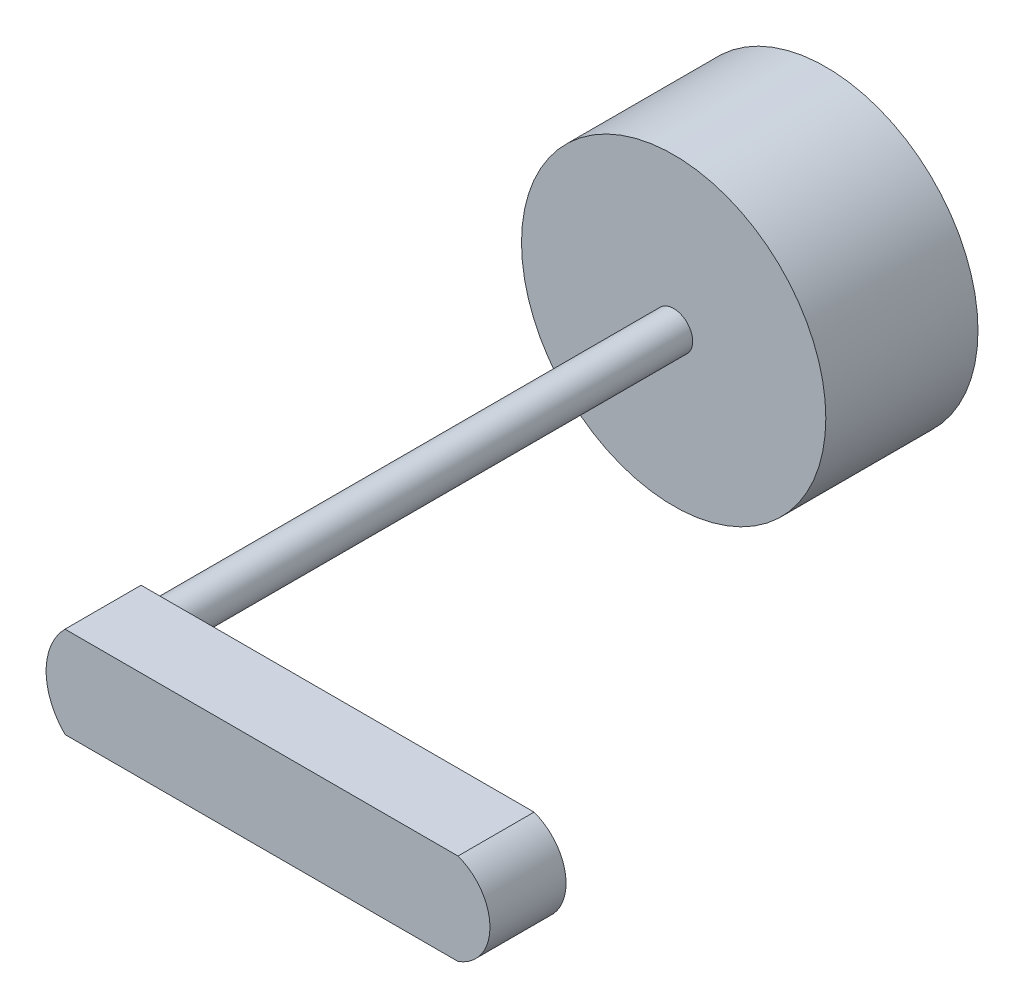
from build123d import *

# Parameters (mm, degrees)
SKETCH_1_R      = 10
EXTRUDE_1_DEPTH = 10
SKETCH_2_R      = 1.25
EXTRUDE_2_DEPTH = 40
EXTRUDE_3_DEPTH = 5


with BuildPart() as part:
    # Эскиз1 → Бобышка-Вытянуть1 (new body)
    with BuildSketch(Plane.XY):
        Circle(SKETCH_1_R)
    extrude(amount=EXTRUDE_1_DEPTH)

    # Эскиз2 → Бобышка-Вытянуть2 (add)
    with BuildSketch(Plane.XY.offset(10)):
        Circle(SKETCH_2_R)
    extrude(amount=EXTRUDE_2_DEPTH)

    # Эскиз3 → Бобышка-Вытянуть3 (add)
    with BuildSketch(Plane.XY.offset(50)):
        with BuildLine():
            Line((0, 3), (25.827062473, 3))
            ThreePointArc((25.827062473, 3), (27.92788481, 0), (25.827062473, -3))
            Line((25.827062473, -3), (0, -3))
            ThreePointArc((0, -3), (-1.242640687, 0), (0, 3))
        make_face()
    extrude(amount=-EXTRUDE_3_DEPTH)


solid = part.part
